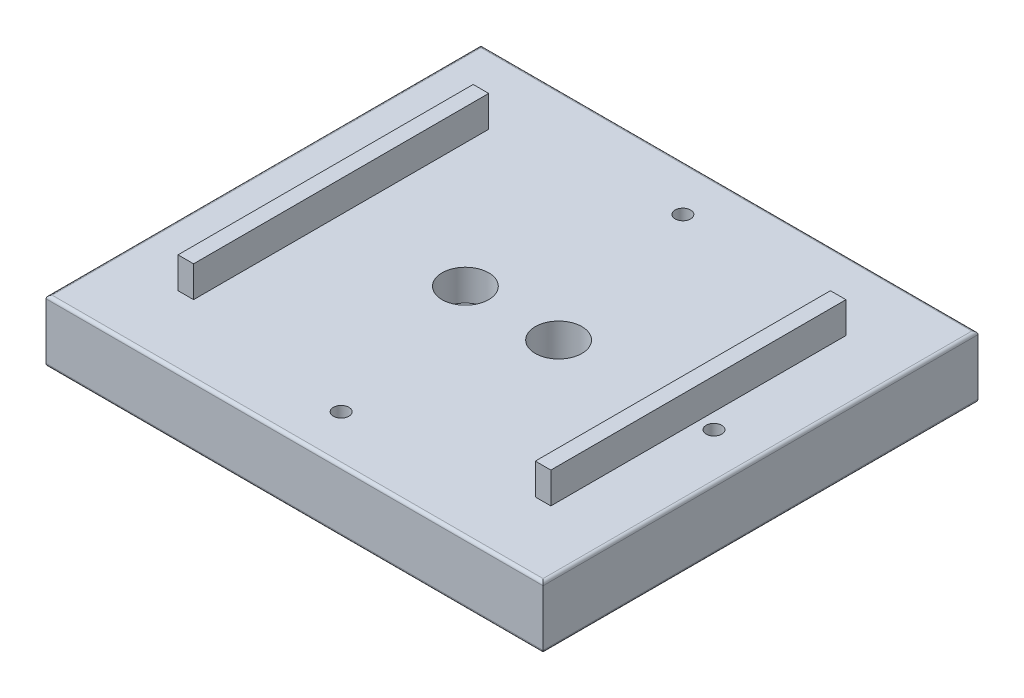
from build123d import *

# Parameters (mm, degrees)
SKETCH1_W                   = 160
SKETCH1_H                   = 140
LID_EXTRUDE_DEPTH           = 20
SKETCH3_W                   = 5
SKETCH3_H                   = 95
LOCATION_BAR_EXTRUDE_DEPTH  = 10
M6_TAPPED_HOLE1_D           = 5
M6_TAPPED_HOLE1_CSINK_D     = 6.05
M6_TAPPED_HOLE1_CSINK_ANGLE = 90
SKETCH6_R                   = 16
MOTOR_HOLE_CUT_DEPTH        = 3.15
FILLET2_R                   = 1
SKETCH7_R                   = 7.5
CUT_EXTRUDE1_DEPTH          = 111.453610172
CUT_EXTRUDE3_START          = -10
SKETCH9_R                   = 7.5
CUT_EXTRUDE3_DEPTH          = 10


with BuildPart() as part:
    # Sketch1 → LID_EXTRUDE (new body)
    with BuildSketch(Plane(origin=(0, 0, 0), x_dir=(1, 0, 0), z_dir=(0, 1, 0))):
        Rectangle(SKETCH1_W, SKETCH1_H)
    extrude(amount=LID_EXTRUDE_DEPTH)

    # Sketch3 → LOCATION_BAR_EXTRUDE (add)
    with BuildSketch(Plane(origin=(0, 20, 0), x_dir=(1, 0, 0), z_dir=(0, 1, 0))):
        with Locations((-57.5, 0)):
            Rectangle(SKETCH3_W, SKETCH3_H)
        with Locations((57.5, 0)):
            Rectangle(SKETCH3_W, SKETCH3_H)
    extrude(amount=LOCATION_BAR_EXTRUDE_DEPTH)

    # M6 Tapped Hole1 (through all)
    with Locations(Plane(origin=(0, 0, 55), x_dir=(0, 0, -1), z_dir=(0, -1, 0))):
        with Locations((0, 0), (55, -65)):
            m6_tapped_hole1 = CounterSinkHole(M6_TAPPED_HOLE1_D / 2, M6_TAPPED_HOLE1_CSINK_D / 2, counter_sink_angle=M6_TAPPED_HOLE1_CSINK_ANGLE)

    # Mirror1: M6 Tapped Hole1 across plane
    add(m6_tapped_hole1.mirror(Plane(origin=(0, 0, 0), x_dir=(0, 0, 1), z_dir=(1, 0, 0))), mode=Mode.SUBTRACT)

    # Mirror1 at the second plane: M6 Tapped Hole1 across plane
    add(m6_tapped_hole1.mirror(Plane.XY), mode=Mode.SUBTRACT)

    # Sketch6 → MOTOR_HOLE_CUT (cut)
    with BuildSketch(Plane.XZ):
        with Locations(Location((15, 0, 0), (0, 0, 270))):
            Circle(SKETCH6_R)
    extrude(amount=-MOTOR_HOLE_CUT_DEPTH, mode=Mode.SUBTRACT)

    # Fillet2
    fillet2_edges = [part.edges().sort_by_distance(p)[0] for p in [
        (80, 20, 0),
        (0, 20, -70),
        (-80, 20, 0),
        (0, 0, -70),
        (80, 0, 0),
        (0, 0, 70),
        (-80, 0, 0),
        (0, 20, 70),
    ]]
    fillet(fillet2_edges, radius=FILLET2_R)

    # Sketch7 → Cut-Extrude1 (cut, through all)
    with BuildSketch(Plane.XZ):
        with Locations(Location((15, 0, 0), (0, 0, 270))):
            Circle(SKETCH7_R)
    extrude(amount=-CUT_EXTRUDE1_DEPTH, mode=Mode.SUBTRACT)

    # Sketch9 → Cut-Extrude3 (cut)
    with BuildSketch(Plane.XZ.offset(CUT_EXTRUDE3_START)):
        with Locations(Location((-15, 0, 0), (0, 0, 90))):
            Circle(SKETCH9_R)
    extrude(amount=-CUT_EXTRUDE3_DEPTH, mode=Mode.SUBTRACT)


solid = part.part
